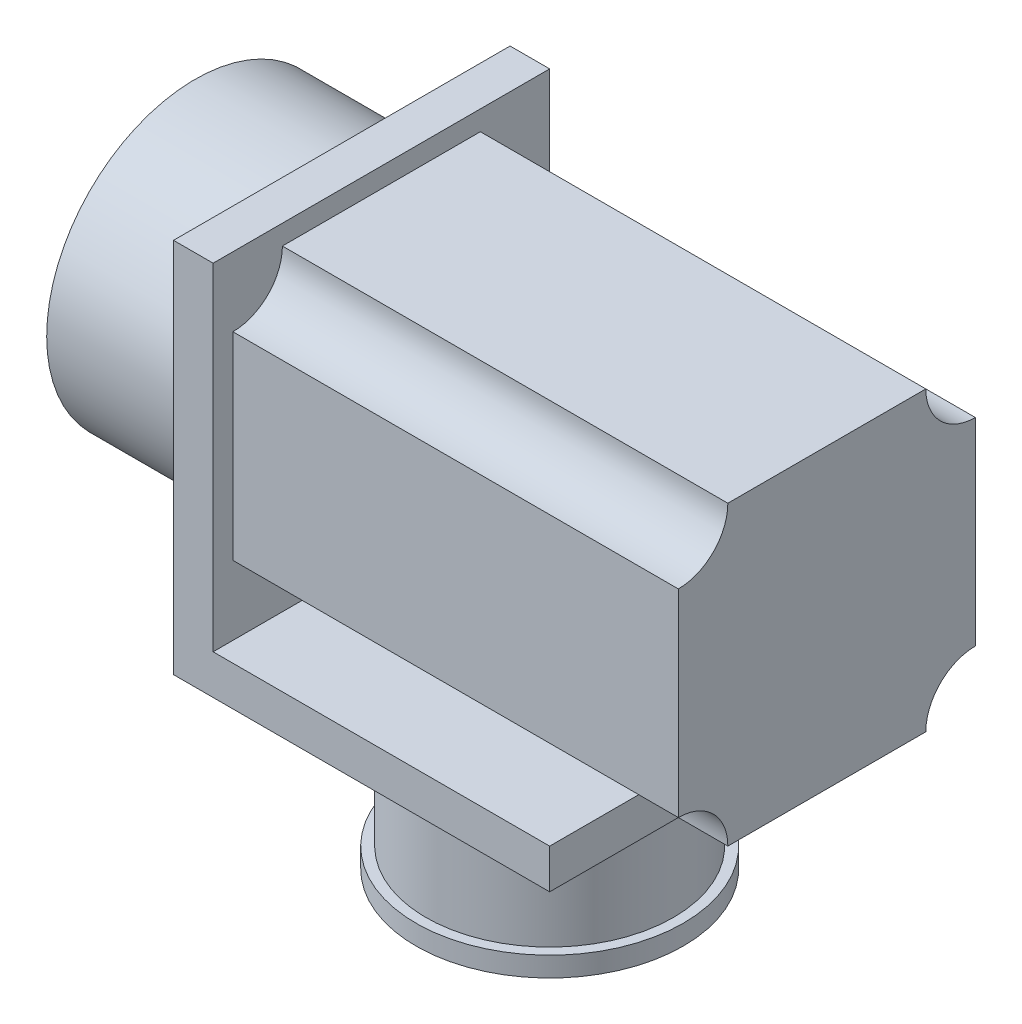
from build123d import *

# Parameters (mm, degrees)
BOSS_EXTRUDE1_DEPTH = 170
SKETCH3_R           = 75
SKETCH3_R_2         = 62.5
BOSS_EXTRUDE2_DEPTH = 75
SKETCH4_W           = 150
SKETCH4_H           = 150
BOSS_EXTRUDE3_DEPTH = 225
CUT_EXTRUDE6_DEPTH  = 225
SKETCH6_R           = 62.5
BOSS_EXTRUDE4_DEPTH = 75
BOSS_EXTRUDE5_START = -10
SKETCH7_R           = 67.5
SKETCH7_R_2         = 62.5
BOSS_EXTRUDE5_DEPTH = 10
SKETCH8_W           = 10
SKETCH8_H           = 12.412745851


with BuildPart() as part:
    # Sketch2 → Boss-Extrude1 (new body)
    with BuildSketch(Plane.XY):
        Polygon((-40.398264296, 30.238450413), (-20.398264296, 30.238450413), (-20.398264296, -139.761549587), (149.601735704, -139.761549587), (149.601735704, -159.761549587), (-40.398264296, -159.761549587), align=None)
    extrude(amount=-BOSS_EXTRUDE1_DEPTH)

    # Sketch3 → Boss-Extrude2 (add)
    with BuildSketch(Plane.ZY.offset(40.398264296)):
        with Locations((-85.93846623, -54.761549587)):
            Circle(SKETCH3_R)
        with Locations((-85.93846623, -54.761549587)):
            Circle(SKETCH3_R_2, mode=Mode.SUBTRACT)
    extrude(amount=BOSS_EXTRUDE2_DEPTH)

    # Sketch4 → Boss-Extrude3 (add)
    with BuildSketch(Plane(origin=(-20.398264296, 0, 0), x_dir=(0, 0, -1), z_dir=(1, 0, 0))):
        with Locations((85, -54.761549587)):
            Rectangle(SKETCH4_W, SKETCH4_H)
    extrude(amount=BOSS_EXTRUDE3_DEPTH)

    # Sketch5 → Cut-Extrude6 (cut)
    with BuildSketch(Plane(origin=(204.601735704, 0, 0), x_dir=(0, 0, -1), z_dir=(1, 0, 0))):
        with BuildLine():
            Line((35, 20.238450413), (10, 20.238450413))
            Line((10, 20.238450413), (10, -4.761549587))
            ThreePointArc((10, -4.761549587), (27.67766953, 2.560780883), (35, 20.238450413))
        make_face()
        with BuildLine():
            ThreePointArc((35, -129.761549587), (27.67766953, -112.083880057), (10, -104.761549587))
            Line((10, -104.761549587), (10, -129.761549587))
            Line((10, -129.761549587), (35, -129.761549587))
        make_face()
        with BuildLine():
            ThreePointArc((160, -104.761549587), (142.32233047, -112.083880057), (135, -129.761549587))
            Line((135, -129.761549587), (160, -129.761549587))
            Line((160, -129.761549587), (160, -104.761549587))
        make_face()
        with BuildLine():
            Line((160, 20.238450413), (135, 20.238450413))
            ThreePointArc((135, 20.238450413), (142.32233047, 2.560780883), (160, -4.761549587))
            Line((160, -4.761549587), (160, 20.238450413))
        make_face()
    extrude(amount=-CUT_EXTRUDE6_DEPTH, mode=Mode.SUBTRACT)

    # Sketch6 → Boss-Extrude4 (add)
    with BuildSketch(Plane.XZ.offset(159.761549587)):
        with Locations((64.601735704, -85)):
            Circle(SKETCH6_R)
    extrude(amount=BOSS_EXTRUDE4_DEPTH)

    # Sketch7 → Boss-Extrude5 (add)
    with BuildSketch(Plane.XZ.offset(234.761549587).offset(BOSS_EXTRUDE5_START)):
        with Locations((64.601735704, -85)):
            Circle(SKETCH7_R)
        with Locations((64.601735704, -85)):
            Circle(SKETCH7_R_2, mode=Mode.SUBTRACT)
    extrude(amount=BOSS_EXTRUDE5_DEPTH)

    # Sketch8 → Cut-Revolve1 (revolve, cut)
    with BuildSketch(Plane.XZ.offset(54.761549587), mode=Mode.PRIVATE) as cut_revolve1_sk:
        with Locations((-45.398264296, -24.644839156)):
            Rectangle(SKETCH8_W, SKETCH8_H)
    revolve(cut_revolve1_sk.sketch.rotate(Axis((-115.398264296, -54.761549587, -85.93846623), (1, 0, 0)), 180), axis=Axis((-115.398264296, -54.761549587, -85.93846623), (1, 0, 0)), mode=Mode.SUBTRACT)


solid = part.part
